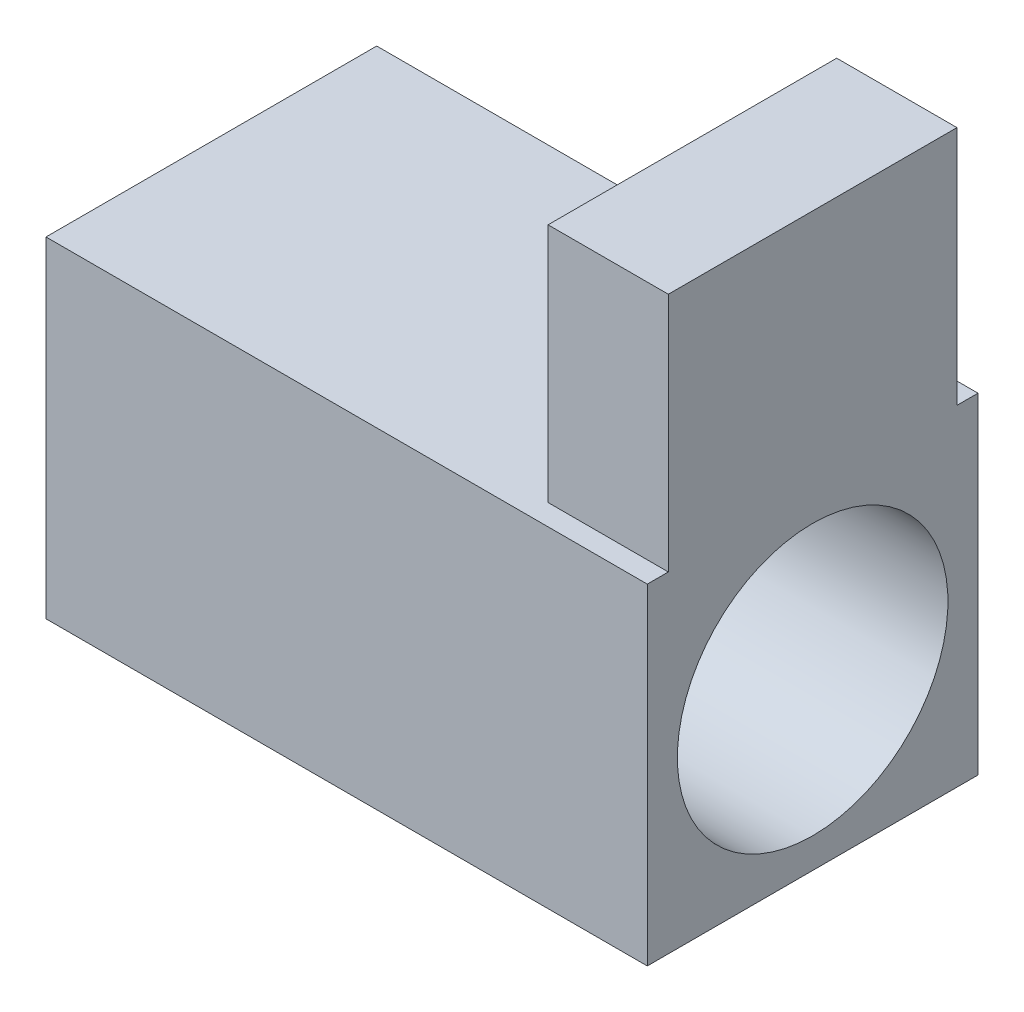
from build123d import *

# Parameters (mm, degrees)
SKETCH2_W           = 10
SKETCH2_H           = 5.5
BOSS_EXTRUDE1_DEPTH = 2.75
SKETCH3_R           = 2.25
CUT_EXTRUDE1_DEPTH  = 5
SKETCH4_W           = 2
SKETCH4_H           = 4.8
BOSS_EXTRUDE2_DEPTH = 4


with BuildPart() as part:
    # Sketch2 → Boss-Extrude1 (new, symmetric)
    with BuildSketch(Plane.XY):
        Rectangle(SKETCH2_W, SKETCH2_H)
    extrude(amount=BOSS_EXTRUDE1_DEPTH, both=True)

    # Sketch3 → Cut-Extrude1 (cut)
    with BuildSketch(Plane(origin=(5, 0, 0), x_dir=(0, 0, -1), z_dir=(1, 0, 0))):
        with Locations(Location((0, 0, 0), (0, 0, 90))):
            Circle(SKETCH3_R)
    extrude(amount=-CUT_EXTRUDE1_DEPTH, mode=Mode.SUBTRACT)

    # Sketch4 → Boss-Extrude2 (add)
    with BuildSketch(Plane(origin=(0, 2.75, 0), x_dir=(1, 0, 0), z_dir=(0, 1, 0))):
        with Locations((4, 0)):
            Rectangle(SKETCH4_W, SKETCH4_H)
    extrude(amount=BOSS_EXTRUDE2_DEPTH)


solid = part.part
